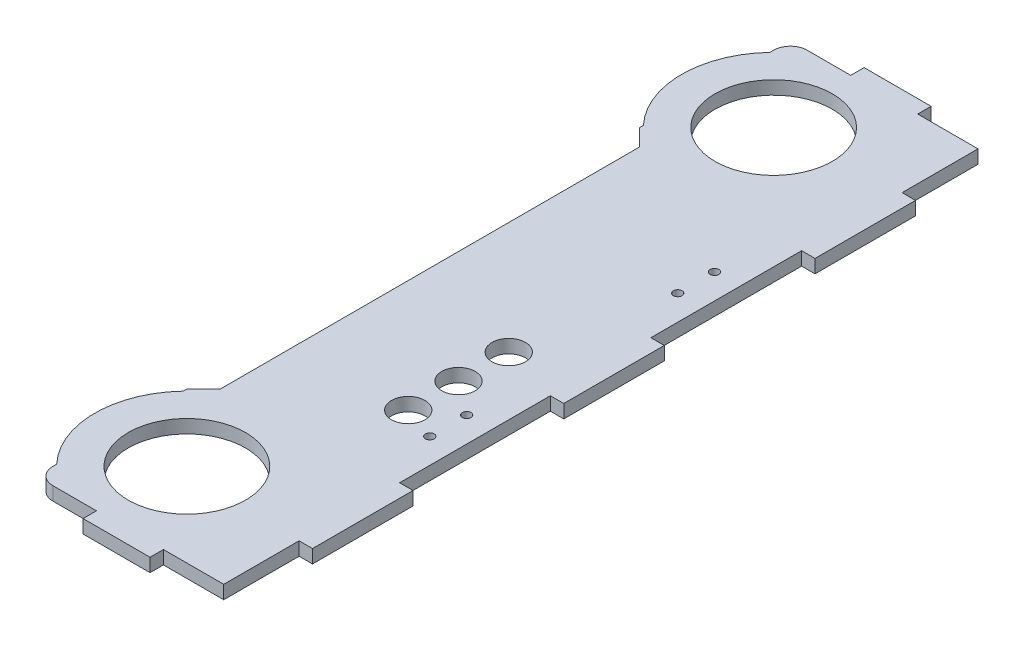
from build123d import *

# Parameters (mm, degrees)
ESQUISSE1_W             = 112
ESQUISSE1_H             = 8
BOSS_EXTRU_1_DEPTH      = 450.3
ENL_V_MAT_EXTRU_1_DEPTH = 10
ESQUISSE3_W             = 40
ESQUISSE3_H             = 8
BOSS_EXTRU_2_DEPTH      = 8
ESQUISSE4_R             = 35
ENL_V_MAT_EXTRU_2_DEPTH = 10
ESQUISSE5_W             = 8
ESQUISSE5_H             = 60
BOSS_EXTRU_3_DEPTH      = 8
BOSS_EXTRU_5_DEPTH      = 8
CONG_1_R                = 10
ESQUISSE8_R             = 2.6
ENL_V_MAT_EXTRU_3_DEPTH = 8
ESQUISSE9_R             = 10
ENL_V_MAT_EXTRU_4_DEPTH = 10


with BuildPart() as part:
    # Esquisse1 → Boss.-Extru.1 (new body)
    with BuildSketch(Plane.XY):
        with Locations((-92, -52)):
            Rectangle(ESQUISSE1_W, ESQUISSE1_H)
    extrude(amount=BOSS_EXTRU_1_DEPTH)

    # Esquisse2 → Enlèv. mat.-Extru.1 (cut)
    with BuildSketch(Plane.XZ.offset(56)):
        Polygon((-148, 360.15), (-138, 350.15), (-138, 100.15), (-148, 90.15), align=None)
    extrude(amount=-ENL_V_MAT_EXTRU_1_DEPTH, mode=Mode.SUBTRACT)

    # Esquisse3 → Boss.-Extru.2 (add)
    with BuildSketch(Plane.XZ.offset(56)):
        with Locations((-92, 454.3)):
            Rectangle(ESQUISSE3_W, ESQUISSE3_H)
        with Locations((-92, -4)):
            Rectangle(ESQUISSE3_W, ESQUISSE3_H)
    extrude(amount=-BOSS_EXTRU_2_DEPTH)

    # Esquisse4 → Enlèv. mat.-Extru.2 (cut)
    with BuildSketch(Plane(origin=(0, -48, 0), x_dir=(1, 0, 0), z_dir=(0, 1, 0))):
        with Locations(Location((-108, -50, 0), (0, 0, 180))):
            Circle(ESQUISSE4_R)
        with Locations(Location((-108, -400.3, 0), (0, 0, 180))):
            Circle(ESQUISSE4_R)
    extrude(amount=-ENL_V_MAT_EXTRU_2_DEPTH, mode=Mode.SUBTRACT)

    # Esquisse5 → Boss.-Extru.3 (add)
    with BuildSketch(Plane.XZ.offset(56)):
        with Locations((-32, 225.3)):
            Rectangle(ESQUISSE5_W, ESQUISSE5_H)
        with Locations((-32, 375.3)):
            Rectangle(ESQUISSE5_W, ESQUISSE5_H)
        with Locations((-32, 75.3)):
            Rectangle(ESQUISSE5_W, ESQUISSE5_H)
    extrude(amount=-BOSS_EXTRU_3_DEPTH)

    # Esquisse7 → Boss.-Extru.5 (add)
    with BuildSketch(Plane.XZ.offset(56)):
        with BuildLine():
            Line((-148, 438.049172176), (-148, 362.550827824))
            ThreePointArc((-148, 362.550827824), (-163, 400.3), (-148, 438.049172176))
        make_face()
        with BuildLine():
            Line((-148, 12.250827824), (-148, 87.749172176))
            ThreePointArc((-148, 87.749172176), (-163, 50), (-148, 12.250827824))
        make_face()
    extrude(amount=-BOSS_EXTRU_5_DEPTH)

    # Congé1
    cong_1_edges = [part.edges().sort_by_distance(p)[0] for p in [
        (-148, -52, 0),
        (-148, -52, 450.3),
    ]]
    fillet(cong_1_edges, radius=CONG_1_R)

    # Esquisse8 → Enlèv. mat.-Extru.3 (cut)
    with BuildSketch(Plane(origin=(0, -48, 0), x_dir=(1, 0, 0), z_dir=(0, 1, 0))):
        with Locations(Location((-51, -142.3, 0), (0, 0, 270))):
            Circle(ESQUISSE8_R)
        with Locations(Location((-51, -164.3, 0), (0, 0, 270))):
            Circle(ESQUISSE8_R)
        with Locations(Location((-51, -312.3, 0), (0, 0, 270))):
            Circle(ESQUISSE8_R)
        with Locations(Location((-51, -290.3, 0), (0, 0, 270))):
            Circle(ESQUISSE8_R)
    extrude(amount=-ENL_V_MAT_EXTRU_3_DEPTH, mode=Mode.SUBTRACT)

    # Esquisse9 → Enlèv. mat.-Extru.4 (cut)
    with BuildSketch(Plane.XZ.offset(56)):
        with Locations((-71, 305.15)):
            Circle(ESQUISSE9_R)
        with Locations((-71, 275.15)):
            Circle(ESQUISSE9_R)
        with Locations((-71, 245.15)):
            Circle(ESQUISSE9_R)
    extrude(amount=-ENL_V_MAT_EXTRU_4_DEPTH, mode=Mode.SUBTRACT)


solid = part.part
